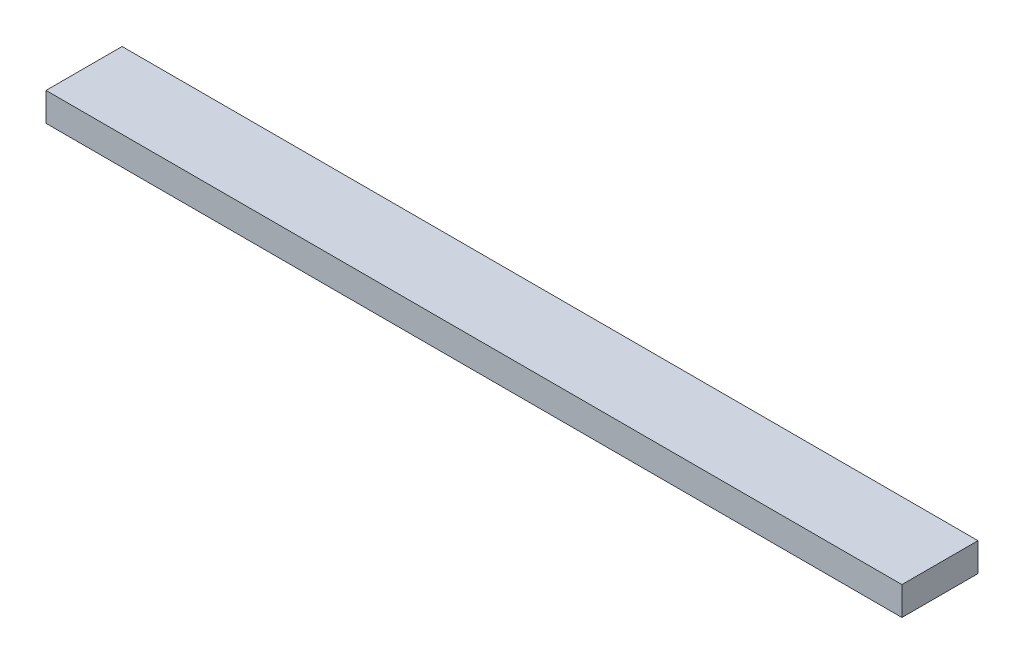
from build123d import *

# Parameters (mm, degrees)
SKETCH3_W           = 90
SKETCH3_H           = 8
BOSS_EXTRUDE2_DEPTH = 3


with BuildPart() as part:
    # Sketch3 → Boss-Extrude2 (new body)
    with BuildSketch(Plane(origin=(0, 0, 0), x_dir=(1, 0, 0), z_dir=(0, 1, 0))):
        Rectangle(SKETCH3_W, SKETCH3_H)
    extrude(amount=BOSS_EXTRUDE2_DEPTH)


solid = part.part
